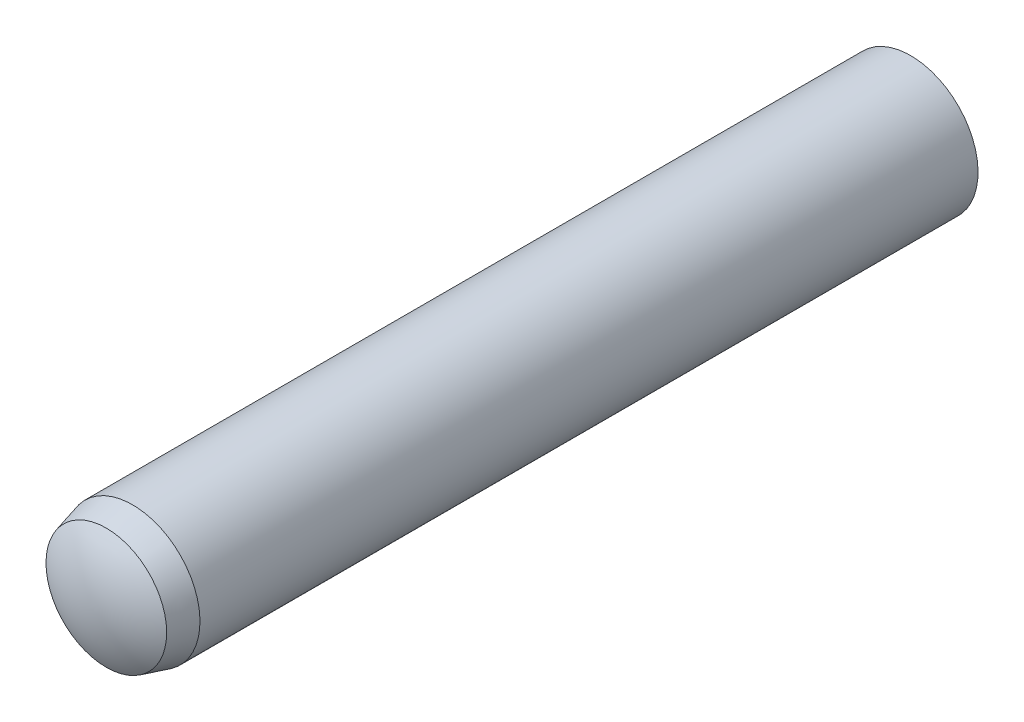
from build123d import *


with BuildPart() as part:
    # Sketch3 → Revolve1 (revolve)
    with BuildSketch(Plane(origin=(0, 0, 0), x_dir=(0, 0, -1), z_dir=(1, 0, 0)), mode=Mode.PRIVATE) as revolve1_sk:
        with BuildLine():
            Line((-25, 0), (25, 0))
            ThreePointArc((25, 0), (24.693537673, 2.088061302), (23.8, 4))
            Line((23.8, 4), (-22.4, 4))
            Line((-22.4, 4), (-23.96, 3.58199926))
            ThreePointArc((-23.96, 3.58199926), (-24.734740106, 1.864961038), (-25, 0))
        make_face()
    revolve(revolve1_sk.sketch.rotate(Axis((0, 0, 25), (0, 0, -1)), 180), axis=Axis((0, 0, 25), (0, 0, -1)))


solid = part.part
